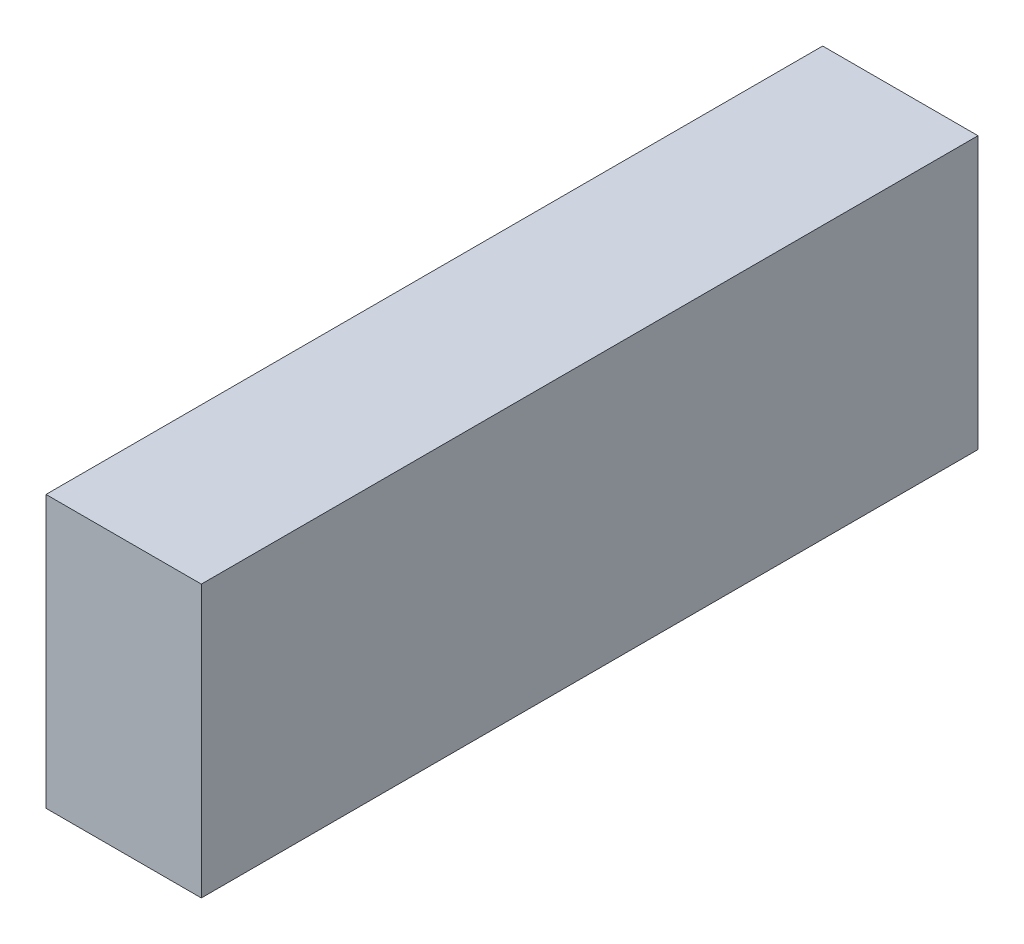
from build123d import *

# Parameters (mm, degrees)
SKIZZE1_W                       = 100
SKIZZE1_H                       = 35
AUFSATZ_LINEAR_AUSTRAGEN1_DEPTH = 20


with BuildPart() as part:
    # Skizze1 → Aufsatz-Linear austragen1 (new body)
    with BuildSketch(Plane(origin=(0, 0, 0), x_dir=(0, 0, -1), z_dir=(1, 0, 0))):
        Rectangle(SKIZZE1_W, SKIZZE1_H)
    extrude(amount=AUFSATZ_LINEAR_AUSTRAGEN1_DEPTH)


solid = part.part
